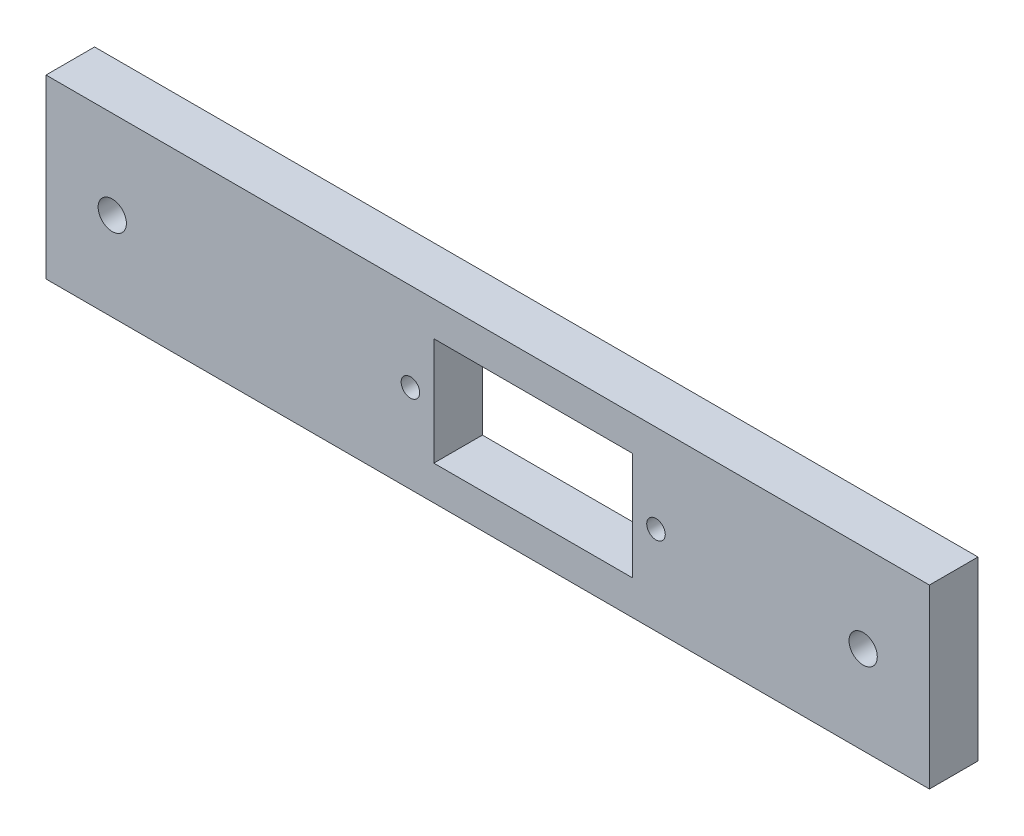
from build123d import *

# Parameters (mm, degrees)
SKETCH_1_W          = 100
SKETCH_1_H          = 20
EXTRUDE_1_DEPTH     = 5.5
SKETCH_2_R          = 1.6
SKETCH_2_R_2        = 1.05
SKETCH_2_W          = 22.5
SKETCH_2_H          = 12.2
CUT_EXTRUDE_1_DEPTH = 52.285962992


with BuildPart() as part:
    # ｽｹｯﾁ1 → ﾎﾞｽ - 押し出し1 (new body)
    with BuildSketch(Plane.XY):
        Rectangle(SKETCH_1_W, SKETCH_1_H)
    extrude(amount=EXTRUDE_1_DEPTH)

    # ｽｹｯﾁ2 → ｶｯﾄ - 押し出し1 (cut, through all)
    with BuildSketch(Plane.XY.offset(5.5)):
        with Locations((-42.5, 0)):
            Circle(SKETCH_2_R)
        with Locations((42.5, 0)):
            Circle(SKETCH_2_R)
        with Locations((-8.75, 0)):
            Circle(SKETCH_2_R_2)
        with Locations((19.05, 0)):
            Circle(SKETCH_2_R_2)
        with Locations((5.15, 0)):
            Rectangle(SKETCH_2_W, SKETCH_2_H)
    extrude(amount=-CUT_EXTRUDE_1_DEPTH, mode=Mode.SUBTRACT)


solid = part.part
